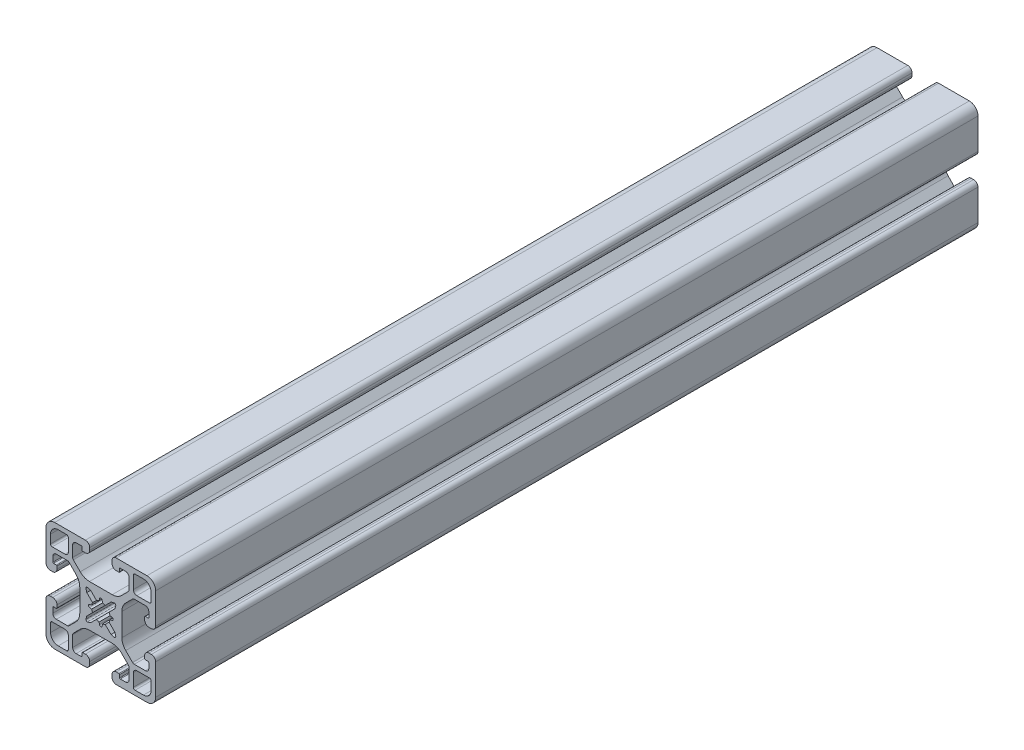
from build123d import *

# Parameters (mm, degrees)
EXTRUDE1_DEPTH = 300


with BuildPart() as part:
    # Sketch1 → Extrude1 (new body)
    with BuildSketch(Plane.XY):
        with BuildLine():
            Line((-5.63, 20), (-16.83, 20))
            ThreePointArc((-16.83, 20), (-19.071528496, 19.071528497), (-20, 16.83))
            Line((-20, 16.83), (-20, 5.63))
            ThreePointArc((-20, 5.63), (-19.540157646, 4.519842354), (-18.43, 4.06))
            Line((-18.43, 4.06), (-17.57, 4.06))
            ThreePointArc((-17.57, 4.06), (-16.459842353, 4.519842354), (-16, 5.63))
            Line((-16, 5.63), (-16, 6.605))
            ThreePointArc((-16, 6.605), (-16.073223305, 6.781776695), (-16.25, 6.855))
            Line((-16.25, 6.855), (-17.25, 6.855))
            ThreePointArc((-17.25, 6.855), (-17.426776695, 6.928223305), (-17.5, 7.105))
            Line((-17.5, 7.105), (-17.5, 9.015))
            ThreePointArc((-17.5, 9.015), (-17.128025612, 9.913025612), (-16.23, 10.285))
            Line((-16.23, 10.285), (-12.216214636, 10.285))
            ThreePointArc((-12.216214636, 10.285), (-11.875626381, 10.217252784), (-11.5868896, 10.024325035))
            Line((-11.5868896, 10.024325035), (-9.076242789, 7.513678224))
            ThreePointArc((-9.076242789, 7.513678224), (-8.046572221, 5.972667318), (-7.685, 4.154921014))
            Line((-7.685, 4.154921014), (-7.685, -4.154921014))
            ThreePointArc((-7.685, -4.154921014), (-8.046572221, -5.972667317), (-9.076242789, -7.513678224))
            Line((-9.076242789, -7.513678224), (-11.5868896, -10.024325035))
            ThreePointArc((-11.5868896, -10.024325035), (-11.875626381, -10.217252784), (-12.216214636, -10.285))
            Line((-12.216214636, -10.285), (-16.23, -10.285))
            ThreePointArc((-16.23, -10.285), (-17.128025612, -9.913025612), (-17.5, -9.015))
            Line((-17.5, -9.015), (-17.5, -7.105))
            ThreePointArc((-17.5, -7.105), (-17.426776695, -6.928223305), (-17.25, -6.855))
            Line((-17.25, -6.855), (-16.25, -6.855))
            ThreePointArc((-16.25, -6.855), (-16.073223305, -6.781776695), (-16, -6.605))
            Line((-16, -6.605), (-16, -5.63))
            ThreePointArc((-16, -5.63), (-16.459842354, -4.519842353), (-17.57, -4.06))
            Line((-17.57, -4.06), (-18.43, -4.06))
            ThreePointArc((-18.43, -4.06), (-19.540157646, -4.519842353), (-20, -5.63))
            Line((-20, -5.63), (-20, -16.83))
            ThreePointArc((-20, -16.83), (-19.071528496, -19.071528496), (-16.83, -20))
            Line((-16.83, -20), (-5.63, -20))
            ThreePointArc((-5.63, -20), (-4.519842354, -19.540157646), (-4.06, -18.43))
            Line((-4.06, -18.43), (-4.06, -17.57))
            ThreePointArc((-4.06, -17.57), (-4.519842354, -16.459842353), (-5.63, -16))
            Line((-5.63, -16), (-6.605, -16))
            ThreePointArc((-6.605, -16), (-6.781776695, -16.073223305), (-6.855, -16.25))
            Line((-6.855, -16.25), (-6.855, -17.25))
            ThreePointArc((-6.855, -17.25), (-6.928223305, -17.426776695), (-7.105, -17.5))
            Line((-7.105, -17.5), (-9.015, -17.5))
            ThreePointArc((-9.015, -17.5), (-9.913025612, -17.128025612), (-10.285, -16.23))
            Line((-10.285, -16.23), (-10.285, -12.216214635))
            ThreePointArc((-10.285, -12.216214635), (-10.217252784, -11.875626381), (-10.024325035, -11.5868896))
            Line((-10.024325035, -11.5868896), (-7.513678224, -9.076242789))
            ThreePointArc((-7.513678224, -9.076242789), (-5.972667317, -8.04657222), (-4.154921014, -7.685))
            Line((-4.154921014, -7.685), (4.154921014, -7.685))
            ThreePointArc((4.154921014, -7.685), (5.972667317, -8.04657222), (7.513678224, -9.076242789))
            Line((7.513678224, -9.076242789), (10.024325035, -11.5868896))
            ThreePointArc((10.024325035, -11.5868896), (10.217252784, -11.875626381), (10.285, -12.216214636))
            Line((10.285, -12.216214636), (10.285, -16.23))
            ThreePointArc((10.285, -16.23), (9.913025612, -17.128025612), (9.015, -17.5))
            Line((9.015, -17.5), (7.105, -17.5))
            ThreePointArc((7.105, -17.5), (6.928223305, -17.426776695), (6.855, -17.25))
            Line((6.855, -17.25), (6.855, -16.25))
            ThreePointArc((6.855, -16.25), (6.781776695, -16.073223305), (6.605, -16))
            Line((6.605, -16), (5.63, -16))
            ThreePointArc((5.63, -16), (4.519842354, -16.459842353), (4.06, -17.57))
            Line((4.06, -17.57), (4.06, -18.43))
            ThreePointArc((4.06, -18.43), (4.519842354, -19.540157646), (5.63, -20))
            Line((5.63, -20), (16.83, -20))
            ThreePointArc((16.83, -20), (19.071528496, -19.071528496), (20, -16.83))
            Line((20, -16.83), (20, -5.63))
            ThreePointArc((20, -5.63), (19.540157646, -4.519842353), (18.43, -4.06))
            Line((18.43, -4.06), (17.57, -4.06))
            ThreePointArc((17.57, -4.06), (16.459842354, -4.519842353), (16, -5.63))
            Line((16, -5.63), (16, -6.605))
            ThreePointArc((16, -6.605), (16.073223305, -6.781776695), (16.25, -6.855))
            Line((16.25, -6.855), (17.25, -6.855))
            ThreePointArc((17.25, -6.855), (17.426776695, -6.928223305), (17.5, -7.105))
            Line((17.5, -7.105), (17.5, -9.015))
            ThreePointArc((17.5, -9.015), (17.128025612, -9.913025612), (16.23, -10.285))
            Line((16.23, -10.285), (12.216214636, -10.285))
            ThreePointArc((12.216214636, -10.285), (11.875626381, -10.217252784), (11.5868896, -10.024325035))
            Line((11.5868896, -10.024325035), (9.076242789, -7.513678224))
            ThreePointArc((9.076242789, -7.513678224), (8.046572221, -5.972667317), (7.685, -4.154921014))
            Line((7.685, -4.154921014), (7.685, 4.154921014))
            ThreePointArc((7.685, 4.154921014), (8.046572221, 5.972667318), (9.076242789, 7.513678224))
            Line((9.076242789, 7.513678224), (11.5868896, 10.024325035))
            ThreePointArc((11.5868896, 10.024325035), (11.875626381, 10.217252784), (12.216214636, 10.285))
            Line((12.216214636, 10.285), (16.23, 10.285))
            ThreePointArc((16.23, 10.285), (17.128025612, 9.913025612), (17.5, 9.015))
            Line((17.5, 9.015), (17.5, 7.105))
            ThreePointArc((17.5, 7.105), (17.426776695, 6.928223305), (17.25, 6.855))
            Line((17.25, 6.855), (16.25, 6.855))
            ThreePointArc((16.25, 6.855), (16.073223305, 6.781776695), (16, 6.605))
            Line((16, 6.605), (16, 5.63))
            ThreePointArc((16, 5.63), (16.459842354, 4.519842354), (17.57, 4.06))
            Line((17.57, 4.06), (18.43, 4.06))
            ThreePointArc((18.43, 4.06), (19.540157646, 4.519842354), (20, 5.63))
            Line((20, 5.63), (20, 16.83))
            ThreePointArc((20, 16.83), (19.071528496, 19.071528496), (16.83, 20))
            Line((16.83, 20), (5.63, 20))
            ThreePointArc((5.63, 20), (4.519842354, 19.540157647), (4.06, 18.43))
            Line((4.06, 18.43), (4.06, 17.57))
            ThreePointArc((4.06, 17.57), (4.519842354, 16.459842354), (5.63, 16))
            Line((5.63, 16), (6.605, 16))
            ThreePointArc((6.605, 16), (6.781776695, 16.073223305), (6.855, 16.25))
            Line((6.855, 16.25), (6.855, 17.25))
            ThreePointArc((6.855, 17.25), (6.928223305, 17.426776695), (7.105, 17.5))
            Line((7.105, 17.5), (9.015, 17.5))
            ThreePointArc((9.015, 17.5), (9.913025612, 17.128025612), (10.285, 16.23))
            Line((10.285, 16.23), (10.285, 12.216214636))
            ThreePointArc((10.285, 12.216214636), (10.217252784, 11.875626381), (10.024325035, 11.5868896))
            Line((10.024325035, 11.5868896), (7.513678224, 9.07624279))
            ThreePointArc((7.513678224, 9.07624279), (5.972667317, 8.046572221), (4.154921014, 7.685))
            Line((4.154921014, 7.685), (-4.154921014, 7.685))
            ThreePointArc((-4.154921014, 7.685), (-5.972667317, 8.046572221), (-7.513678224, 9.07624279))
            Line((-7.513678224, 9.07624279), (-10.024325035, 11.5868896))
            ThreePointArc((-10.024325035, 11.5868896), (-10.217252784, 11.875626381), (-10.285, 12.216214636))
            Line((-10.285, 12.216214636), (-10.285, 16.23))
            ThreePointArc((-10.285, 16.23), (-9.913025612, 17.128025612), (-9.015, 17.5))
            Line((-9.015, 17.5), (-7.105, 17.5))
            ThreePointArc((-7.105, 17.5), (-6.928223305, 17.426776695), (-6.855, 17.25))
            Line((-6.855, 17.25), (-6.855, 16.25))
            ThreePointArc((-6.855, 16.25), (-6.781776695, 16.073223305), (-6.605, 16))
            Line((-6.605, 16), (-5.63, 16))
            ThreePointArc((-5.63, 16), (-4.519842354, 16.459842354), (-4.06, 17.57))
            Line((-4.06, 17.57), (-4.06, 18.43))
            ThreePointArc((-4.06, 18.43), (-4.519842354, 19.540157647), (-5.63, 20))
        make_face()
        with BuildLine():
            Line((12.4898, -18.345), (15.545, -18.345))
            ThreePointArc((15.545, -18.345), (17.524898987, -17.524898987), (18.345, -15.545))
            Line((18.345, -15.545), (18.345, -12.4898))
            ThreePointArc((18.345, -12.4898), (18.160477272, -12.044322728), (17.715, -11.8598))
            Line((17.715, -11.8598), (13.1298, -11.8598))
            ThreePointArc((13.1298, -11.8598), (12.231774388, -12.231774388), (11.8598, -13.1298))
            Line((11.8598, -13.1298), (11.8598, -17.715))
            ThreePointArc((11.8598, -17.715), (12.044322728, -18.160477272), (12.4898, -18.345))
        make_face(mode=Mode.SUBTRACT)
        with BuildLine():
            Line((-18.345, -12.4898), (-18.345, -15.545))
            ThreePointArc((-18.345, -15.545), (-17.524898987, -17.524898987), (-15.545, -18.345))
            Line((-15.545, -18.345), (-12.4898, -18.345))
            ThreePointArc((-12.4898, -18.345), (-12.044322728, -18.160477272), (-11.8598, -17.715))
            Line((-11.8598, -17.715), (-11.8598, -13.1298))
            ThreePointArc((-11.8598, -13.1298), (-12.231774388, -12.231774388), (-13.1298, -11.8598))
            Line((-13.1298, -11.8598), (-17.715, -11.8598))
            ThreePointArc((-17.715, -11.8598), (-18.160477272, -12.044322728), (-18.345, -12.4898))
        make_face(mode=Mode.SUBTRACT)
        with BuildLine():
            Line((18.345, 12.4898), (18.345, 15.545))
            ThreePointArc((18.345, 15.545), (17.524898987, 17.524898987), (15.545, 18.345))
            Line((15.545, 18.345), (12.4898, 18.345))
            ThreePointArc((12.4898, 18.345), (12.044322728, 18.160477272), (11.8598, 17.715))
            Line((11.8598, 17.715), (11.8598, 13.1298))
            ThreePointArc((11.8598, 13.1298), (12.231774388, 12.231774388), (13.1298, 11.8598))
            Line((13.1298, 11.8598), (17.715, 11.8598))
            ThreePointArc((17.715, 11.8598), (18.160477272, 12.044322728), (18.345, 12.4898))
        make_face(mode=Mode.SUBTRACT)
        with BuildLine():
            Line((-12.4898, 18.345), (-15.545, 18.345))
            ThreePointArc((-15.545, 18.345), (-17.524898987, 17.524898987), (-18.345, 15.545))
            Line((-18.345, 15.545), (-18.345, 12.4898))
            ThreePointArc((-18.345, 12.4898), (-18.160477272, 12.044322728), (-17.715, 11.8598))
            Line((-17.715, 11.8598), (-13.1298, 11.8598))
            ThreePointArc((-13.1298, 11.8598), (-12.231774388, 12.231774388), (-11.8598, 13.1298))
            Line((-11.8598, 13.1298), (-11.8598, 17.715))
            ThreePointArc((-11.8598, 17.715), (-12.044322728, 18.160477272), (-12.4898, 18.345))
        make_face(mode=Mode.SUBTRACT)
        with BuildLine():
            Line((-4.84811685, -5.43930974), (-3.712038621, -5.126252183))
            Line((-3.712038621, -5.126252183), (-1.590718277, -3.00493184))
            ThreePointArc((-1.590718277, -3.00493184), (-1.120609643, -3.210020877), (-0.625, -3.342061489))
            Line((-0.625, -3.342061489), (-0.492259234, -4.087640441))
            ThreePointArc((-0.492259234, -4.087640441), (0, -4.5), (0.492259234, -4.087640441))
            Line((0.492259234, -4.087640441), (0.625, -3.342061489))
            ThreePointArc((0.625, -3.342061489), (1.120609643, -3.210020877), (1.590718277, -3.00493184))
            Line((1.590718277, -3.00493184), (3.712038621, -5.126252183))
            Line((3.712038621, -5.126252183), (4.84811685, -5.43930974))
            ThreePointArc((4.84811685, -5.43930974), (5.303300859, -5.303300859), (5.43930974, -4.84811685))
            Line((5.43930974, -4.84811685), (5.126252183, -3.712038621))
            Line((5.126252183, -3.712038621), (3.00493184, -1.590718277))
            ThreePointArc((3.00493184, -1.590718277), (3.210020877, -1.120609643), (3.342061489, -0.625))
            Line((3.342061489, -0.625), (4.087640441, -0.492259234))
            ThreePointArc((4.087640441, -0.492259234), (4.5, 0), (4.087640441, 0.492259234))
            Line((4.087640441, 0.492259234), (3.342061489, 0.625))
            ThreePointArc((3.342061489, 0.625), (3.210020877, 1.120609643), (3.00493184, 1.590718277))
            Line((3.00493184, 1.590718277), (5.126252183, 3.712038621))
            Line((5.126252183, 3.712038621), (5.43930974, 4.84811685))
            ThreePointArc((5.43930974, 4.84811685), (5.303300859, 5.303300859), (4.84811685, 5.43930974))
            Line((4.84811685, 5.43930974), (3.712038621, 5.126252183))
            Line((3.712038621, 5.126252183), (1.590718277, 3.00493184))
            ThreePointArc((1.590718277, 3.00493184), (1.120609643, 3.210020877), (0.625, 3.342061489))
            Line((0.625, 3.342061489), (0.492259234, 4.087640441))
            ThreePointArc((0.492259234, 4.087640441), (0, 4.5), (-0.492259234, 4.087640441))
            Line((-0.492259234, 4.087640441), (-0.625, 3.342061489))
            ThreePointArc((-0.625, 3.342061489), (-1.120609643, 3.210020877), (-1.590718277, 3.00493184))
            Line((-1.590718277, 3.00493184), (-3.712038621, 5.126252183))
            Line((-3.712038621, 5.126252183), (-4.84811685, 5.43930974))
            ThreePointArc((-4.84811685, 5.43930974), (-5.303300859, 5.303300859), (-5.43930974, 4.84811685))
            Line((-5.43930974, 4.84811685), (-5.126252183, 3.712038621))
            Line((-5.126252183, 3.712038621), (-3.00493184, 1.590718277))
            ThreePointArc((-3.00493184, 1.590718277), (-3.210020877, 1.120609643), (-3.342061489, 0.625))
            Line((-3.342061489, 0.625), (-4.087640441, 0.492259234))
            ThreePointArc((-4.087640441, 0.492259234), (-4.5, 0), (-4.087640441, -0.492259234))
            Line((-4.087640441, -0.492259234), (-3.342061489, -0.625))
            ThreePointArc((-3.342061489, -0.625), (-3.210020877, -1.120609643), (-3.00493184, -1.590718277))
            Line((-3.00493184, -1.590718277), (-5.126252183, -3.712038621))
            Line((-5.126252183, -3.712038621), (-5.43930974, -4.84811685))
            ThreePointArc((-5.43930974, -4.84811685), (-5.303300859, -5.303300859), (-4.84811685, -5.43930974))
        make_face(mode=Mode.SUBTRACT)
    extrude(amount=-EXTRUDE1_DEPTH)


solid = part.part
